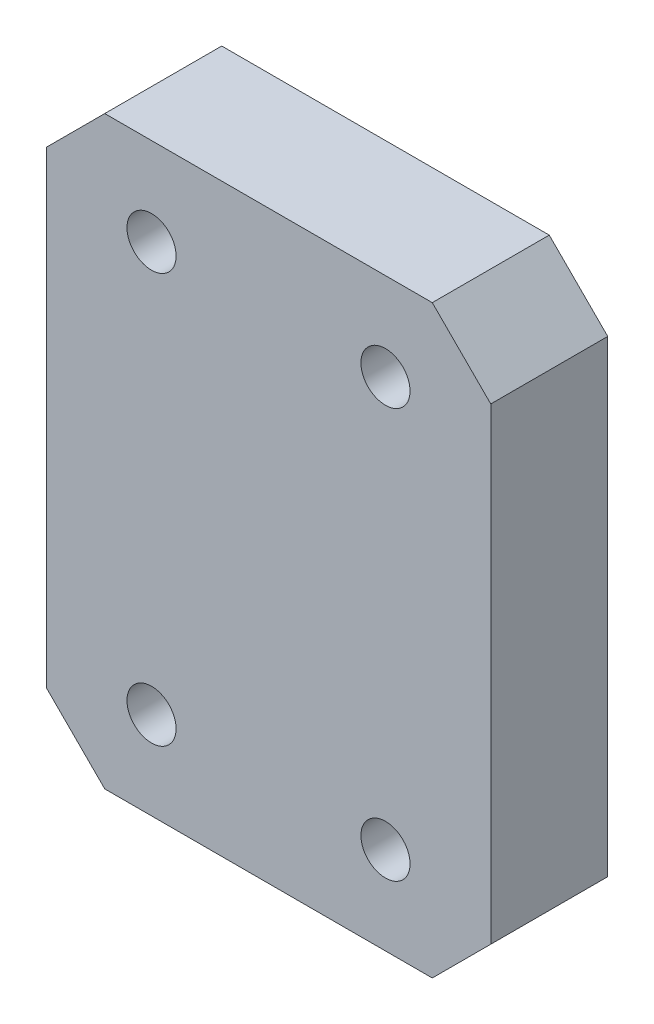
from build123d import *

# Parameters (mm, degrees)
SKETCH_1_W          = 38
SKETCH_1_H          = 50
EXTRUDE_1_DEPTH     = 10
CHAMFER_1_SIZE      = 5
CUT_EXTRUDE_1_REACH = 34.955
SKETCH_2_R          = 2.1


with BuildPart() as part:
    # 草圖1 → 填料-伸長1 (new body)
    with BuildSketch(Plane.XY):
        Rectangle(SKETCH_1_W, SKETCH_1_H)
    extrude(amount=EXTRUDE_1_DEPTH)

    # 導角1
    chamfer_1_edges = [part.edges().sort_by_distance(p)[0] for p in [
        (19, -25, 5),
        (-19, -25, 5),
        (-19, 25, 5),
        (19, 25, 5),
    ]]
    chamfer(chamfer_1_edges, length=CHAMFER_1_SIZE)

    # 草圖2 → 除料-伸長1 (cut, up to next)
    with BuildSketch(Plane(origin=(0, 0, 0), x_dir=(-1, 0, 0), z_dir=(0, 0, -1)), mode=Mode.PRIVATE) as cut_extrude_1_sk1:
        with Locations((-10, 17.5)):
            Circle(SKETCH_2_R)
    cut_extrude_1_tool1 = extrude(cut_extrude_1_sk1.sketch, amount=-CUT_EXTRUDE_1_REACH, mode=Mode.PRIVATE) & part.part
    # 草圖2 → 除料-伸長1 (cut, up to next)
    with BuildSketch(Plane(origin=(0, 0, 0), x_dir=(-1, 0, 0), z_dir=(0, 0, -1)), mode=Mode.PRIVATE) as cut_extrude_1_sk2:
        with Locations((10, 17.5)):
            Circle(SKETCH_2_R)
    cut_extrude_1_tool2 = extrude(cut_extrude_1_sk2.sketch, amount=-CUT_EXTRUDE_1_REACH, mode=Mode.PRIVATE) & part.part
    # 草圖2 → 除料-伸長1 (cut, up to next)
    with BuildSketch(Plane(origin=(0, 0, 0), x_dir=(-1, 0, 0), z_dir=(0, 0, -1)), mode=Mode.PRIVATE) as cut_extrude_1_sk3:
        with Locations((-10, -17.5)):
            Circle(SKETCH_2_R)
    cut_extrude_1_tool3 = extrude(cut_extrude_1_sk3.sketch, amount=-CUT_EXTRUDE_1_REACH, mode=Mode.PRIVATE) & part.part
    # 草圖2 → 除料-伸長1 (cut, up to next)
    with BuildSketch(Plane(origin=(0, 0, 0), x_dir=(-1, 0, 0), z_dir=(0, 0, -1)), mode=Mode.PRIVATE) as cut_extrude_1_sk4:
        with Locations((10, -17.5)):
            Circle(SKETCH_2_R)
    cut_extrude_1_tool4 = extrude(cut_extrude_1_sk4.sketch, amount=-CUT_EXTRUDE_1_REACH, mode=Mode.PRIVATE) & part.part
    add(cut_extrude_1_tool1.solids().sort_by_distance((10, 17.5, 0))[0], mode=Mode.SUBTRACT)
    add(cut_extrude_1_tool2.solids().sort_by_distance((-10, 17.5, 0))[0], mode=Mode.SUBTRACT)
    add(cut_extrude_1_tool3.solids().sort_by_distance((10, -17.5, 0))[0], mode=Mode.SUBTRACT)
    add(cut_extrude_1_tool4.solids().sort_by_distance((-10, -17.5, 0))[0], mode=Mode.SUBTRACT)


solid = part.part
